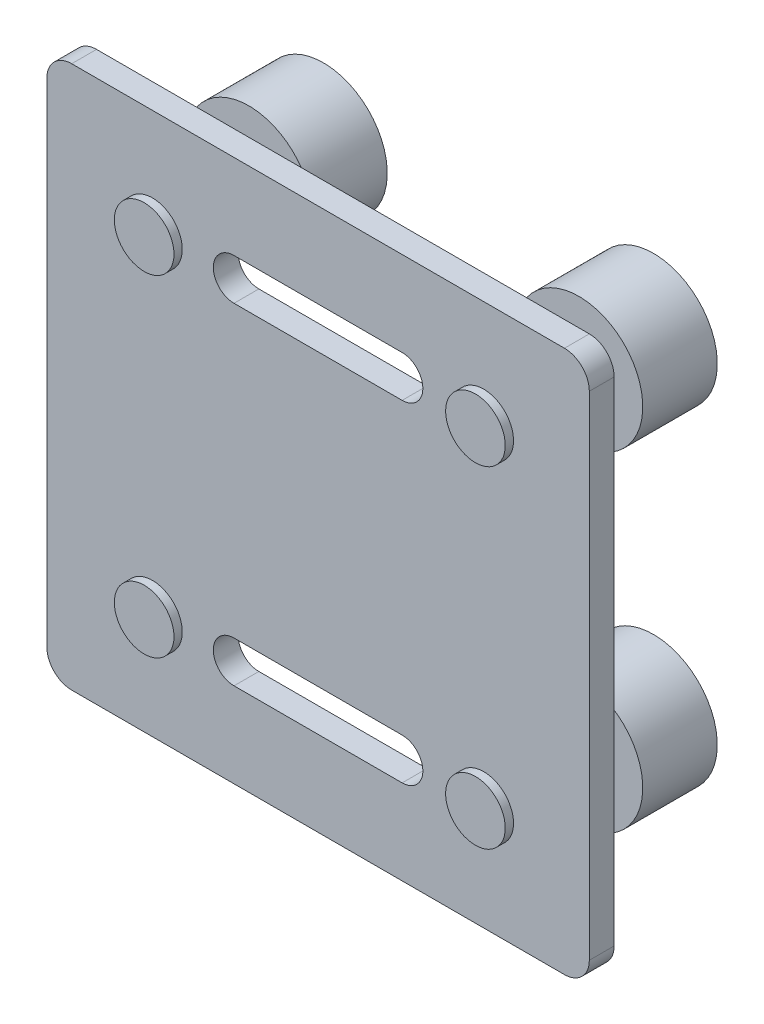
from build123d import *

# Parameters (mm, degrees)
SKETCH_1_W           = 65.5
SKETCH_1_H           = 65.5
SKETCH_1_R           = 3.6
EXTRUDE_1_DEPTH      = 3
FILLET_1_R           = 3
EXTRUDE_2_DEPTH      = 1
EXTRUDE_2_DEPTH_BACK = 11.5
SKETCH_3_R           = 3.6
SKETCH_4_R           = 7.7
EXTRUDE_3_DEPTH      = 9


with BuildPart() as part:
    # 草图1 → 凸台-拉伸1 (new body)
    with BuildSketch(Plane.XY):
        Rectangle(SKETCH_1_W, SKETCH_1_H)
        with Locations((-20, 20)):
            Circle(SKETCH_1_R, mode=Mode.SUBTRACT)
        with Locations(Location((20, 20, 0), (0, 0, 180))):
            Circle(SKETCH_1_R, mode=Mode.SUBTRACT)
        with Locations((20, -20)):
            Circle(SKETCH_1_R, mode=Mode.SUBTRACT)
        with Locations(Location((-20, -20, 0), (0, 0, 180))):
            Circle(SKETCH_1_R, mode=Mode.SUBTRACT)
        with BuildLine():
            Line((-10.15, 22.5), (10.15, 22.5))
            ThreePointArc((10.15, 22.5), (12.65, 20), (10.15, 17.5))
            Line((10.15, 17.5), (-10.15, 17.5))
            ThreePointArc((-10.15, 17.5), (-12.65, 20), (-10.15, 22.5))
        make_face(mode=Mode.SUBTRACT)
        with BuildLine():
            Line((-10.15, -22.5), (10.15, -22.5))
            ThreePointArc((10.15, -22.5), (12.65, -20), (10.15, -17.5))
            Line((10.15, -17.5), (-10.15, -17.5))
            ThreePointArc((-10.15, -17.5), (-12.65, -20), (-10.15, -22.5))
        make_face(mode=Mode.SUBTRACT)
    extrude(amount=EXTRUDE_1_DEPTH)

    # 圆角1
    fillet_1_edges = [part.edges().sort_by_distance(p)[0] for p in [
        (-32.75, 32.75, 1.5),
        (32.75, 32.75, 1.5),
        (32.75, -32.75, 1.5),
        (-32.75, -32.75, 1.5),
    ]]
    fillet(fillet_1_edges, radius=FILLET_1_R)

    # 草图3 → 凸台-拉伸2 (add, two sides: drawn at the far end of the back side and taken through both)
    with BuildSketch(Plane.XY.offset(3).offset(-EXTRUDE_2_DEPTH_BACK)):
        with Locations((-20, 20)):
            Circle(SKETCH_3_R)
        with Locations((-20, -20)):
            Circle(SKETCH_3_R)
        with Locations((20, 20)):
            Circle(SKETCH_3_R)
        with Locations((20, -20)):
            Circle(SKETCH_3_R)
    extrude(amount=EXTRUDE_2_DEPTH + EXTRUDE_2_DEPTH_BACK)

    # 草图4 → 凸台-拉伸3 (add)
    with BuildSketch(Plane(origin=(0, 0, -8.5), x_dir=(-1, 0, 0), z_dir=(0, 0, -1))):
        with Locations((-20, -20)):
            Circle(SKETCH_4_R)
        with Locations((-20, 19.85)):
            Circle(SKETCH_4_R)
        with Locations((19.85, 19.85)):
            Circle(SKETCH_4_R)
        with Locations((19.85, -20)):
            Circle(SKETCH_4_R)
    extrude(amount=EXTRUDE_3_DEPTH)


solid = part.part
